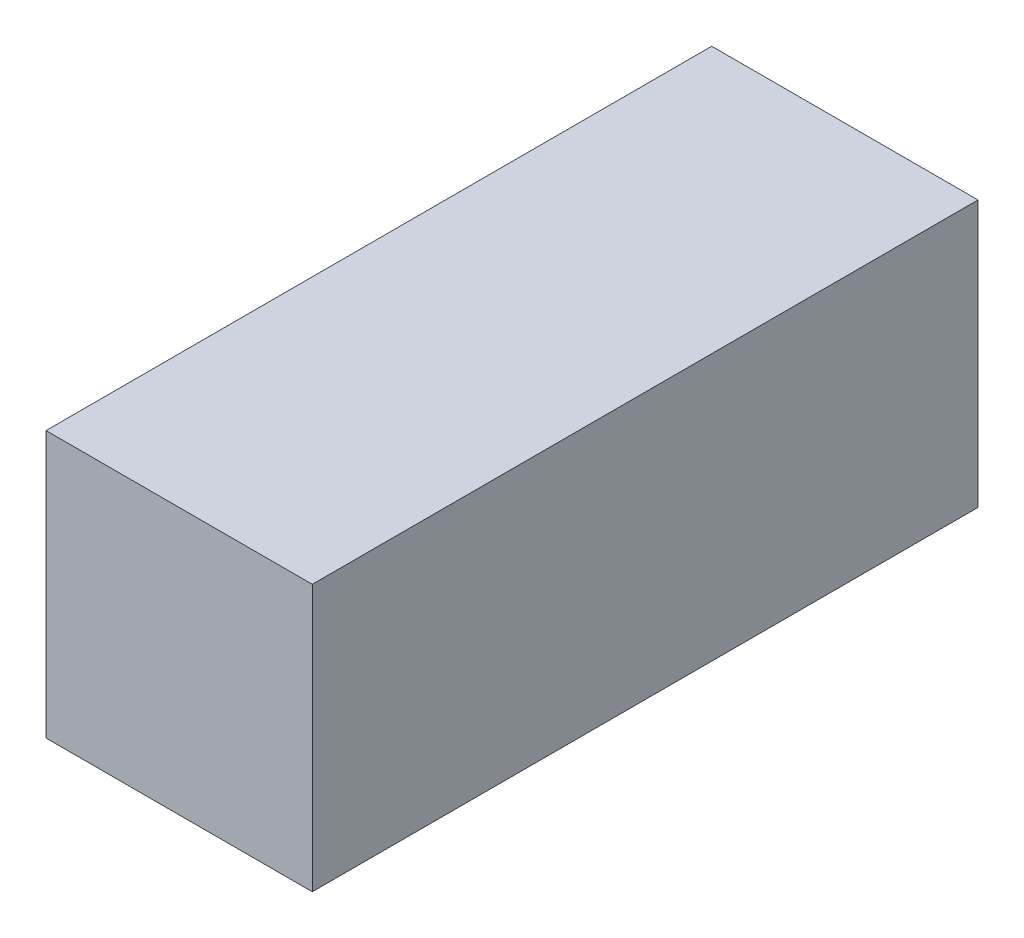
from build123d import *

# Parameters (mm, degrees)
SKETCH_1_W      = 200
SKETCH_1_H      = 200
EXTRUDE_1_DEPTH = 500


with BuildPart() as part:
    # ｽｹｯﾁ1 → ﾎﾞｽ - 押し出し1 (new body)
    with BuildSketch(Plane.XY):
        with Locations((100, 100)):
            Rectangle(SKETCH_1_W, SKETCH_1_H)
    extrude(amount=EXTRUDE_1_DEPTH)


solid = part.part
